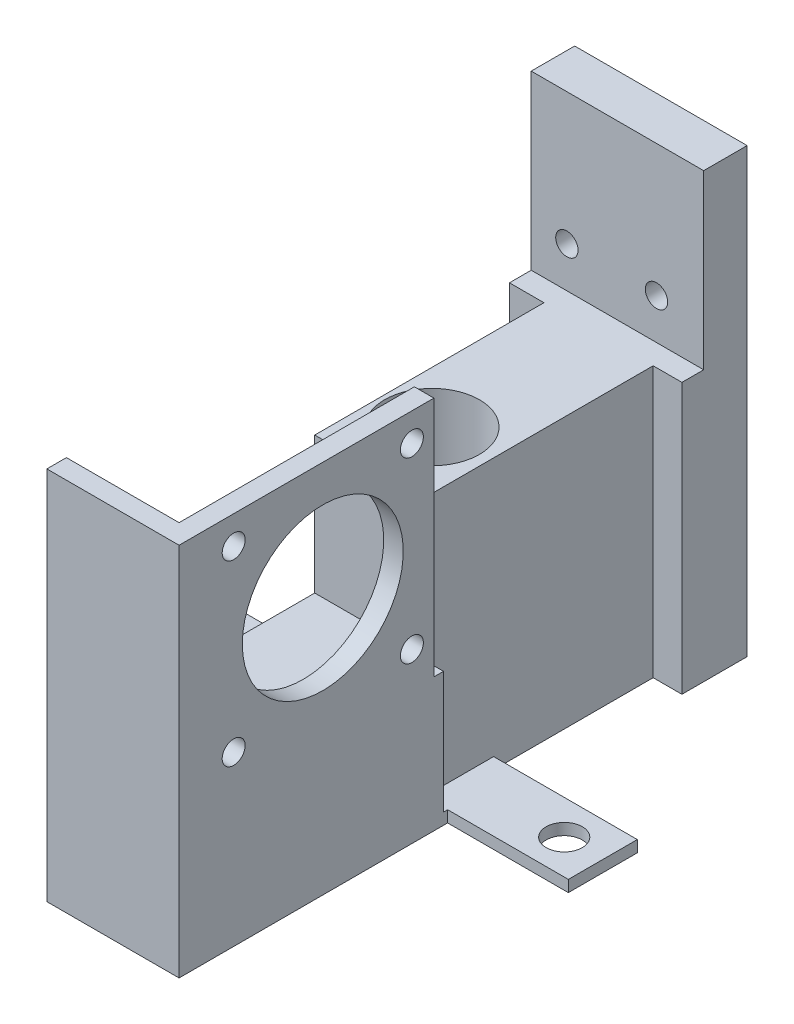
from build123d import *

# Parameters (mm, degrees)
SKETCH1_R           = 3.15
SKETCH1_R_2         = 8.25
BOSS_EXTRUDE1_DEPTH = 2
BOSS_EXTRUDE2_DEPTH = 45
SKETCH3_R           = 8.25
CUT_EXTRUDE1_DEPTH  = 104.812694214
SKETCH4_W           = 30
SKETCH4_H           = 7.560001502
BOSS_EXTRUDE3_DEPTH = 30
SKETCH5_R           = 1.945
CUT_EXTRUDE2_DEPTH  = 130.889649736
CUT_EXTRUDE3_DEPTH  = 120.90444312
SKETCH10_W          = 23
SKETCH10_H          = 46
BOSS_EXTRUDE4_DEPTH = 21.2
SKETCH11_W          = 22.207892016
SKETCH11_H          = 46.715728752
CUT_EXTRUDE4_DEPTH  = 119.384613888
SKETCH12_W          = 0.6
SKETCH12_H          = 23.8
CUT_EXTRUDE5_DEPTH  = 118.813722566
BOSS_EXTRUDE5_DEPTH = 42
SKETCH14_R          = 14
CUT_EXTRUDE6_DEPTH  = 119.420577709
SKETCH15_R          = 2
CUT_EXTRUDE7_DEPTH  = 119.420577709


with BuildPart() as part:
    # Sketch1 → Boss-Extrude1 (new body)
    with BuildSketch(Plane(origin=(0, 0, 0), x_dir=(1, 0, 0), z_dir=(0, 1, 0))):
        Polygon((-48.732366868, 38.443096859), (21.267633132, 38.443096859), (21.267633132, -31.556903141), (21.267633132, -79.857572586), (-48.732366868, -79.857572586), (-48.732366868, -31.556903141), align=None)
        with Locations((-42.016638116, 31.727368106)):
            Circle(SKETCH1_R, mode=Mode.SUBTRACT)
        with Locations((14.551904379, 31.727368106)):
            Circle(SKETCH1_R, mode=Mode.SUBTRACT)
        with Locations((14.551904379, -24.841174389)):
            Circle(SKETCH1_R, mode=Mode.SUBTRACT)
        with Locations((-42.016638116, -24.841174389)):
            Circle(SKETCH1_R, mode=Mode.SUBTRACT)
        with Locations((-13.732366868, -19.556903141)):
            Circle(SKETCH1_R_2, mode=Mode.SUBTRACT)
    extrude(amount=BOSS_EXTRUDE1_DEPTH)

    # Sketch2 → Boss-Extrude2 (add)
    with BuildSketch(Plane(origin=(0, 2, 0), x_dir=(1, 0, 0), z_dir=(0, 1, 0))):
        Polygon((-28.732366868, 20.263098361), (1.267633132, 20.263098361), (1.267633132, 8.916503275), (-3.732366868, 8.916503275), (-3.732366868, -31.556903141), (-22.732366868, -31.556903141), (-22.732366868, 5.987652995), (-22.732366868, 8.916503275), (-28.732366868, 8.916503275), (-28.732366868, 9.103096859), align=None)
    extrude(amount=BOSS_EXTRUDE2_DEPTH)

    # Sketch3 → Cut-Extrude1 (cut, through all)
    with BuildSketch(Plane.XZ.offset(-2)):
        with Locations((-13.732366868, 19.556903141)):
            Circle(SKETCH3_R)
    extrude(amount=-CUT_EXTRUDE1_DEPTH, mode=Mode.SUBTRACT)

    # Sketch4 → Boss-Extrude3 (add)
    with BuildSketch(Plane(origin=(0, 47, 0), x_dir=(1, 0, 0), z_dir=(0, 1, 0))):
        with Locations((-13.732366868, 16.48309761)):
            Rectangle(SKETCH4_W, SKETCH4_H)
    extrude(amount=BOSS_EXTRUDE3_DEPTH)

    # Sketch5 → Cut-Extrude2 (cut, through all)
    with BuildSketch(Plane.XY.offset(-12.703096859)):
        with Locations((-22.527366868, 54.069519899)):
            Circle(SKETCH5_R)
        with Locations((-6.937366868, 54.069519899)):
            Circle(SKETCH5_R)
    extrude(amount=-CUT_EXTRUDE2_DEPTH, mode=Mode.SUBTRACT)

    # Sketch6 → Cut-Extrude3 (cut, through all)
    with BuildSketch(Plane(origin=(0, 2, 0), x_dir=(1, 0, 0), z_dir=(0, 1, 0))):
        Polygon((-48.732366868, -18.841174389), (-22.732366868, -18.841174389), (-22.732366868, 8.916503275), (-28.732366868, 8.916503275), (-28.732366868, 12.703096859), (-28.732366868, 20.263098361), (1.267633132, 20.263098361), (1.267633132, 8.916503275), (-3.732366868, 8.916503275), (-3.732366868, -18.841174389), (21.267633132, -18.841174389), (21.267633132, 38.443096859), (-48.732366868, 38.443096859), align=None)
        Polygon((-48.732366868, -30.841174389), (-44.940258884, -30.841174389), (-44.940258884, -77.556903141), (0.267633132, -77.556903141), (0.267633132, -30.841174389), (21.267633132, -30.841174389), (21.267633132, -79.857572586), (-48.732366868, -79.857572586), align=None)
    extrude(amount=-CUT_EXTRUDE3_DEPTH, mode=Mode.SUBTRACT)

    # Sketch10 → Boss-Extrude4 (add)
    with BuildSketch(Plane(origin=(0, 2, 0), x_dir=(1, 0, 0), z_dir=(0, 1, 0))):
        with Locations((-11.232366868, -54.556903141)):
            Rectangle(SKETCH10_W, SKETCH10_H)
    extrude(amount=BOSS_EXTRUDE4_DEPTH)

    # Sketch11 → Cut-Extrude4 (cut, through all)
    with BuildSketch(Plane(origin=(0, 2, 0), x_dir=(1, 0, 0), z_dir=(0, 1, 0))):
        with Locations((-33.836312876, -54.199038765)):
            Rectangle(SKETCH11_W, SKETCH11_H)
    extrude(amount=-CUT_EXTRUDE4_DEPTH, mode=Mode.SUBTRACT)

    # Sketch12 → Cut-Extrude5 (cut, through all)
    with BuildSketch(Plane.ZY.offset(22.732366868)):
        with Locations((31.256903141, 35.1)):
            Rectangle(SKETCH12_W, SKETCH12_H)
    extrude(amount=-CUT_EXTRUDE5_DEPTH, mode=Mode.SUBTRACT)

    # Sketch13 → Boss-Extrude5 (add)
    with BuildSketch(Plane(origin=(0, 23.2, 0), x_dir=(1, 0, 0), z_dir=(0, 1, 0))):
        Polygon((0.267633132, -77.556903141), (-22.732366868, -77.556903141), (-22.732366868, -74.156903141), (-3.132366868, -74.156903141), (-3.132366868, -33.22347783), (0.267633132, -33.22347783), (0.267633132, -74.156903141), align=None)
    extrude(amount=BOSS_EXTRUDE5_DEPTH)

    # Sketch14 → Cut-Extrude6 (cut, through all)
    with BuildSketch(Plane.ZY.offset(3.132366868)):
        with Locations((52.556903141, 44.785296811)):
            Circle(SKETCH14_R)
    extrude(amount=-CUT_EXTRUDE6_DEPTH, mode=Mode.SUBTRACT)

    # Sketch15 → Cut-Extrude7 (cut, through all)
    with BuildSketch(Plane.ZY.offset(3.132366868)):
        with Locations((68.056903141, 29.285296811)):
            Circle(SKETCH15_R)
        with Locations((37.056903141, 29.285296811)):
            Circle(SKETCH15_R)
        with Locations((37.056903141, 60.285296811)):
            Circle(SKETCH15_R)
        with Locations((68.056903141, 60.285296811)):
            Circle(SKETCH15_R)
    extrude(amount=-CUT_EXTRUDE7_DEPTH, mode=Mode.SUBTRACT)


solid = part.part
